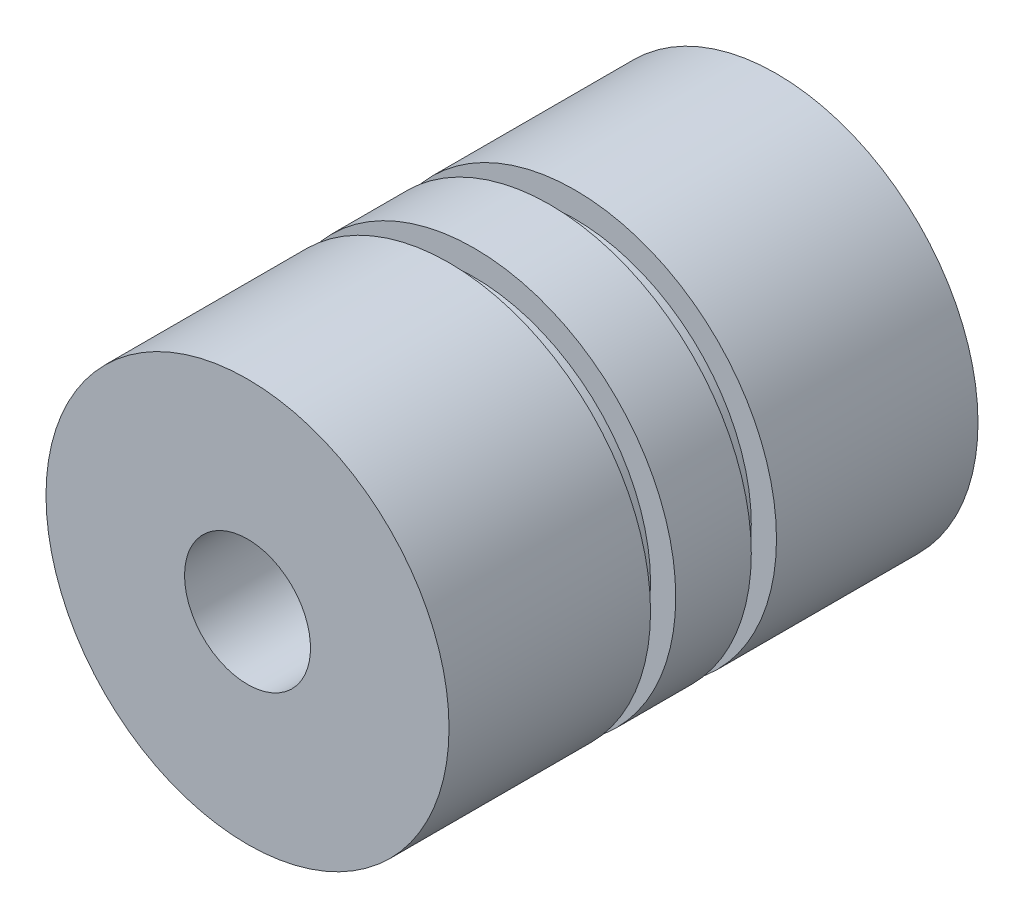
from build123d import *

# Parameters (mm, degrees)
SKETCH_1_R          = 16
SKETCH_1_R_2        = 5
EXTRUDE_1_DEPTH     = 21
SKETCH_2_R          = 7
CUT_EXTRUDE_1_DEPTH = 30
CUT_EXTRUDE_START   = 5
SKETCH_3_R          = 16
SKETCH_3_R_2        = 14
CUT_EXTRUDE_3_DEPTH = 2
CUT_EXTRUDE_START_2 = -3
SKETCH_3_2_R        = 16
SKETCH_3_2_R_2      = 14
CUT_EXTRUDE_4_DEPTH = 2


with BuildPart() as part:
    # 스케치1 → 보스-돌출1 (new, symmetric)
    with BuildSketch(Plane.XY):
        Circle(SKETCH_1_R)
        Circle(SKETCH_1_R_2, mode=Mode.SUBTRACT)
    extrude(amount=EXTRUDE_1_DEPTH, both=True)

    # 스케치2 → 컷-돌출1 (cut)
    with BuildSketch(Plane(origin=(0, 0, -21), x_dir=(-1, 0, 0), z_dir=(0, 0, -1))):
        Circle(SKETCH_2_R)
    extrude(amount=-CUT_EXTRUDE_1_DEPTH, mode=Mode.SUBTRACT)

    # 스케치3 → 컷-돌출3 (cut)
    with BuildSketch(Plane.XY.offset(CUT_EXTRUDE_START)):
        Circle(SKETCH_3_R)
        Circle(SKETCH_3_R_2, mode=Mode.SUBTRACT)
    extrude(amount=-CUT_EXTRUDE_3_DEPTH, mode=Mode.SUBTRACT)

    # 스케치3<2> → 컷-돌출4 (cut)
    with BuildSketch(Plane.XY.offset(CUT_EXTRUDE_START_2)):
        Circle(SKETCH_3_2_R)
        Circle(SKETCH_3_2_R_2, mode=Mode.SUBTRACT)
    extrude(amount=-CUT_EXTRUDE_4_DEPTH, mode=Mode.SUBTRACT)


solid = part.part
